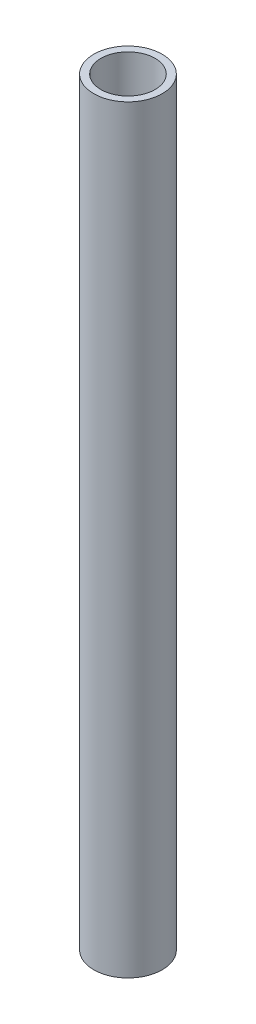
from build123d import *

# Parameters (mm, degrees)
IZIM1_R                     = 12
IZIM1_R_2                   = 9.5
Y_KSEKLIK_EKSTR_ZYON1_DEPTH = 266


with BuildPart() as part:
    # Çizim1 → Yükseklik-Ekstrüzyon1 (new body)
    with BuildSketch(Plane(origin=(0, 0, 0), x_dir=(1, 0, 0), z_dir=(0, 1, 0))):
        with Locations(Location((0, 0, 0), (0, 0, 270))):
            Circle(IZIM1_R)
        with Locations(Location((0, 0, 0), (0, 0, 270))):
            Circle(IZIM1_R_2, mode=Mode.SUBTRACT)
    extrude(amount=Y_KSEKLIK_EKSTR_ZYON1_DEPTH)


solid = part.part
